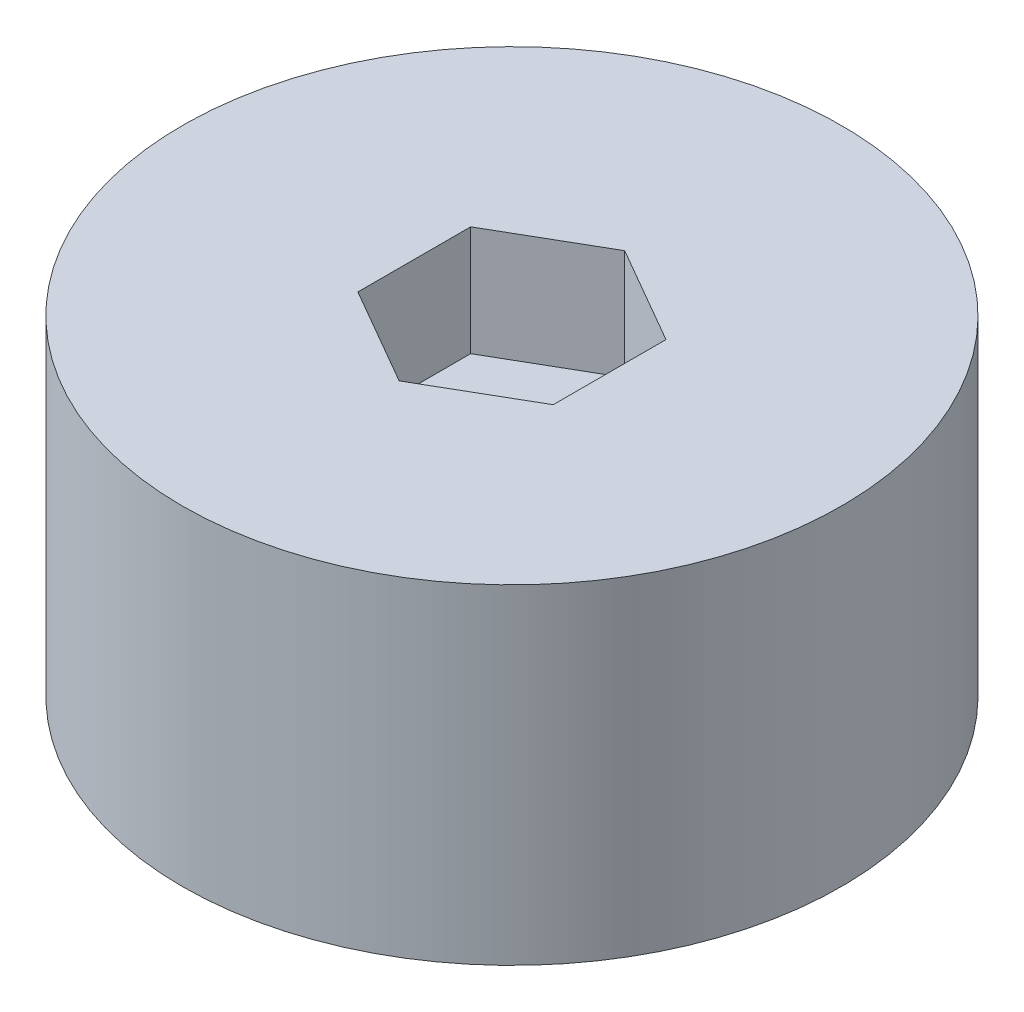
from build123d import *

# Parameters (mm, degrees)
SKETCH1_R           = 15
BOSS_EXTRUDE1_DEPTH = 15
SKETCH2_R           = 10.48
CUT_EXTRUDE1_DEPTH  = 4
CUT_EXTRUDE2_DEPTH  = 5


with BuildPart() as part:
    # Sketch1 → Boss-Extrude1 (new body)
    with BuildSketch(Plane(origin=(0, 0, 0), x_dir=(1, 0, 0), z_dir=(0, 1, 0))):
        with Locations(Location((0, 0, 0), (0, 0, 270))):
            Circle(SKETCH1_R)
    extrude(amount=BOSS_EXTRUDE1_DEPTH)

    # Sketch2 → Cut-Extrude1 (cut)
    with BuildSketch(Plane.XZ):
        with Locations(Location((0, 0, 0), (0, 0, 270))):
            Circle(SKETCH2_R)
    extrude(amount=-CUT_EXTRUDE1_DEPTH, mode=Mode.SUBTRACT)

    # Sketch7 → Cut-Extrude2 (cut)
    with BuildSketch(Plane(origin=(0, 15, 0), x_dir=(1, 0, 0), z_dir=(0, 1, 0))):
        Polygon((0, 5.132643893), (-4.445, 2.566321947), (-4.445, -2.566321947), (0, -5.132643893), (4.445, -2.566321947), (4.445, 2.566321947), align=None)
    extrude(amount=-CUT_EXTRUDE2_DEPTH, mode=Mode.SUBTRACT)


solid = part.part
